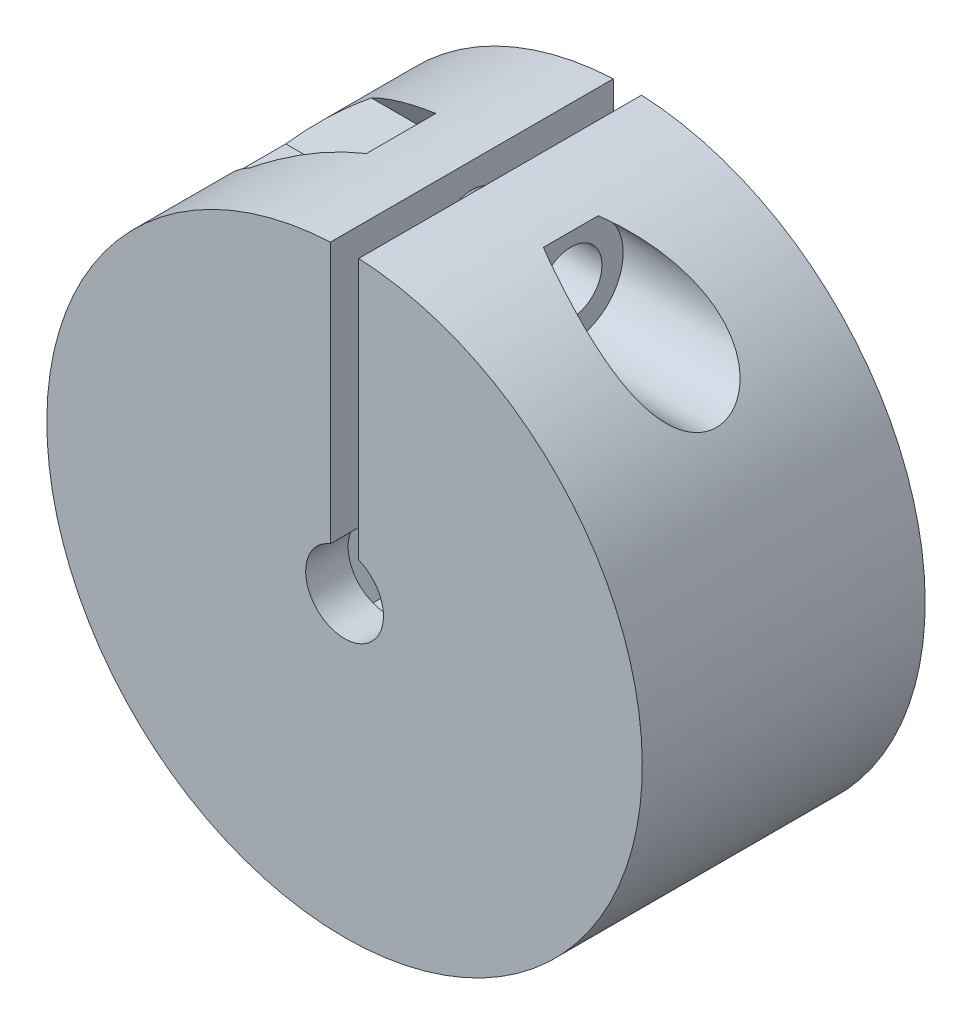
from build123d import *

# Parameters (mm, degrees)
SCHIZZO1_R                    = 21.05
SCHIZZO1_R_2                  = 6.05
ESTRUSIONE_ESTRUSIONE1_DEPTH  = 20
ESTRUSIONE_ESTRUSIONE2_START  = -8
SCHIZZO6_R                    = 6.05
ESTRUSIONE_ESTRUSIONE2_DEPTH  = 8
SCHIZZO8_R                    = 2.75
ESTRUSIONE_ESTRUSIONE3_DEPTH  = 3
SCHIZZO2_W                    = 2
SCHIZZO2_H                    = 24.903468066
TAGLIO_ESTRUSIONE1_DEPTH      = 20
TAGLIO_ESTRUSIONE2_DEPTH      = 37.459635215
TAGLIO_ESTRUSIONE2_DEPTH_BACK = 37.459635215
SCHIZZO3_R                    = 2.2
TAGLIO_ESTRUSIONE3_START      = -5
SCHIZZO4_R                    = 3.7
TAGLIO_ESTRUSIONE3_DEPTH      = 20
TAGLIO_ESTRUSIONE4_START      = -5
TAGLIO_ESTRUSIONE4_DEPTH      = 20
SMUSSO1_SIZE                  = 1


with BuildPart() as part:
    # Schizzo1 → Estrusione-Estrusione1 (new body)
    with BuildSketch(Plane.XY):
        Circle(SCHIZZO1_R)
        Circle(SCHIZZO1_R_2, mode=Mode.SUBTRACT)
    extrude(amount=ESTRUSIONE_ESTRUSIONE1_DEPTH)

    # Schizzo6 → Estrusione-Estrusione2 (add)
    with BuildSketch(Plane.XY.offset(20).offset(ESTRUSIONE_ESTRUSIONE2_START)):
        Circle(SCHIZZO6_R)
        Polygon((2.470277929, 4.03869537), (-2.262473824, 4.158671125), (-4.732751753, 0.119975756), (-2.470277929, -4.03869537), (2.262473824, -4.158671125), (4.732751753, -0.119975756), align=None, mode=Mode.SUBTRACT)
    extrude(amount=ESTRUSIONE_ESTRUSIONE2_DEPTH)

    # Schizzo8 → Estrusione-Estrusione3 (add)
    with BuildSketch(Plane.XY.offset(20)):
        Polygon((-2.262473824, 4.158671125), (-4.732751753, 0.119975756), (-2.470277929, -4.03869537), (2.262473824, -4.158671125), (4.732751753, -0.119975756), (2.470277929, 4.03869537), align=None)
        Circle(SCHIZZO8_R, mode=Mode.SUBTRACT)
    extrude(amount=-ESTRUSIONE_ESTRUSIONE3_DEPTH)

    # Schizzo2 → Taglio-Estrusione1 (cut)
    with BuildSketch(Plane.XY.offset(20)):
        with Locations((0, 13.402032425)):
            Rectangle(SCHIZZO2_W, SCHIZZO2_H)
    extrude(amount=-TAGLIO_ESTRUSIONE1_DEPTH, mode=Mode.SUBTRACT)

    # Schizzo3 → Taglio-Estrusione2 (cut, two sides: drawn at the far end of the back side and taken through both)
    with BuildSketch(Plane.ZY.offset(-1).offset(-TAGLIO_ESTRUSIONE2_DEPTH_BACK)):
        with Locations((10, 17.026233614)):
            Circle(SCHIZZO3_R)
    extrude(amount=TAGLIO_ESTRUSIONE2_DEPTH + TAGLIO_ESTRUSIONE2_DEPTH_BACK, mode=Mode.SUBTRACT)

    # Schizzo4 → Taglio-Estrusione3 (cut)
    with BuildSketch(Plane.ZY.offset(-1).offset(TAGLIO_ESTRUSIONE3_START)):
        with Locations((10, 17.026233614)):
            Circle(SCHIZZO4_R)
    extrude(amount=-TAGLIO_ESTRUSIONE3_DEPTH, mode=Mode.SUBTRACT)

    # Schizzo5 → Taglio-Estrusione4 (cut)
    with BuildSketch(Plane(origin=(-1, 0, 0), x_dir=(0, 0, -1), z_dir=(1, 0, 0)).offset(TAGLIO_ESTRUSIONE4_START)):
        Polygon((-7.863804004, 20.726233614), (-12.136195996, 20.726233614), (-14.272391992, 17.026233614), (-12.136195996, 13.326233614), (-7.863804004, 13.326233614), (-5.727608008, 17.026233614), align=None)
    extrude(amount=-TAGLIO_ESTRUSIONE4_DEPTH, mode=Mode.SUBTRACT)

    # Smusso1
    smusso1_edges = [part.edges().sort_by_distance(p)[0] for p in [
        (0, -6.05, 0),
    ]]
    chamfer(smusso1_edges, length=SMUSSO1_SIZE)


solid = part.part
